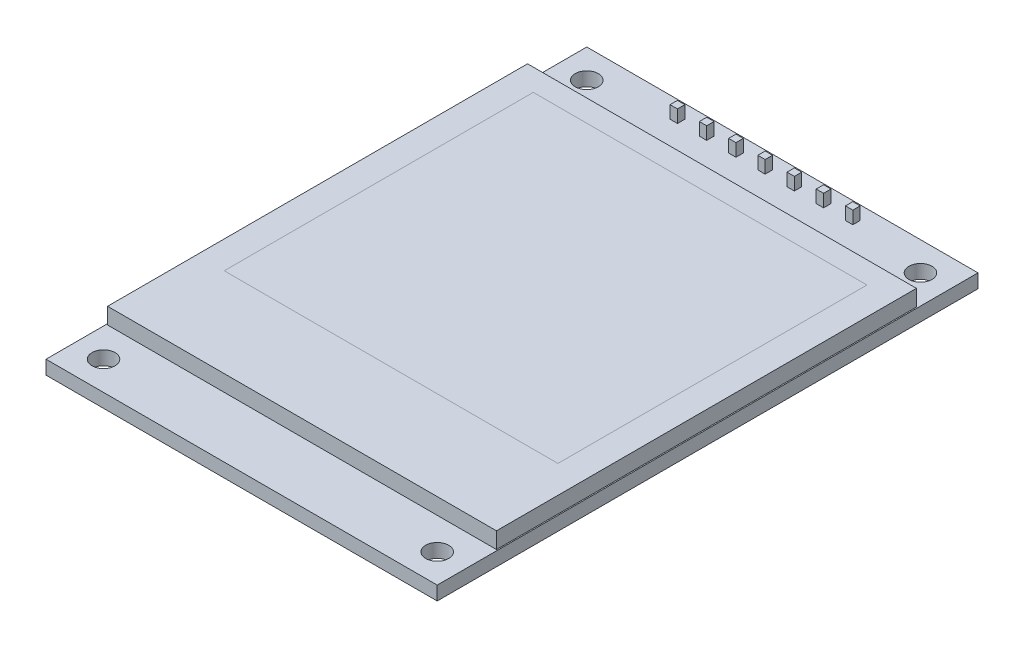
from build123d import *

# Parameters (mm, degrees)
PCB_2_W                   = 34
PCB_2_H                   = 47
PCB_2_R                   = 1
PCB_DEPTH                 = 1.2
OLED_2_W                  = 29
OLED_2_H                  = 26.86
OLED_DEPTH                = 1.41
OLED_3_2_W                = 29
OLED_3_2_H                = 26.86
OLED_3_DEPTH              = 1.41
SKETCH_2_54_W             = 17.78
SKETCH_2_54_H             = 2.54
SKETCH_2_54_W_2           = 0.64
SKETCH_2_54_H_2           = 0.64
EXTRUDE_2_54_0_DEPTH      = 2.5
EXTRUDE_2_54_1_DEPTH      = 9
EXTRUDE_2_54_1_DEPTH_BACK = 2.3
SKETCH_2_54_3_W           = 0.64
SKETCH_2_54_3_H           = 0.64


with BuildPart() as part:
    # PCB 2 → PCB (new body)
    with BuildSketch(Plane(origin=(0, 0, 0), x_dir=(1, 0, 0), z_dir=(0, 1, 0))):
        Rectangle(PCB_2_W, PCB_2_H)
        with Locations((-14.5, 21)):
            Circle(PCB_2_R, mode=Mode.SUBTRACT)
        with Locations((14.5, 21)):
            Circle(PCB_2_R, mode=Mode.SUBTRACT)
        with Locations((-14.5, -21)):
            Circle(PCB_2_R, mode=Mode.SUBTRACT)
        with Locations((14.5, -21)):
            Circle(PCB_2_R, mode=Mode.SUBTRACT)
    extrude(amount=PCB_DEPTH)

    # OLED 2 → OLED (add)
    with BuildSketch(Plane(origin=(0, 1.2, 0), x_dir=(1, 0, 0), z_dir=(0, 1, 0))):
        with Locations((0, 2.92)):
            Rectangle(OLED_2_W, OLED_2_H)
    extrude(amount=OLED_DEPTH)

    # 2.54针脚草图 → 2.54针脚0 (add)
    with BuildSketch(Plane.XZ):
        with Locations((0, -22)):
            Rectangle(SKETCH_2_54_W, SKETCH_2_54_H)
        with Locations((7.62, -22)):
            Rectangle(SKETCH_2_54_W_2, SKETCH_2_54_H_2, mode=Mode.SUBTRACT)
        with Locations((5.08, -22)):
            Rectangle(SKETCH_2_54_W_2, SKETCH_2_54_H_2, mode=Mode.SUBTRACT)
        with Locations((2.54, -22)):
            Rectangle(SKETCH_2_54_W_2, SKETCH_2_54_H_2, mode=Mode.SUBTRACT)
        with Locations((0, -22)):
            Rectangle(SKETCH_2_54_W_2, SKETCH_2_54_H_2, mode=Mode.SUBTRACT)
        with Locations((-2.54, -22)):
            Rectangle(SKETCH_2_54_W_2, SKETCH_2_54_H_2, mode=Mode.SUBTRACT)
        with Locations((-5.08, -22)):
            Rectangle(SKETCH_2_54_W_2, SKETCH_2_54_H_2, mode=Mode.SUBTRACT)
        with Locations((-7.62, -22)):
            Rectangle(SKETCH_2_54_W_2, SKETCH_2_54_H_2, mode=Mode.SUBTRACT)
    extrude(amount=EXTRUDE_2_54_0_DEPTH)

    # 2.54针脚草图<3> → 2.54针脚1 (add, two sides: drawn at the far end of the back side and taken through both)
    with BuildSketch(Plane.XZ.offset(-EXTRUDE_2_54_1_DEPTH_BACK)):
        with Locations((7.62, -22)):
            Rectangle(SKETCH_2_54_3_W, SKETCH_2_54_3_H)
        with Locations((5.08, -22)):
            Rectangle(SKETCH_2_54_3_W, SKETCH_2_54_3_H)
        with Locations((2.54, -22)):
            Rectangle(SKETCH_2_54_3_W, SKETCH_2_54_3_H)
        with Locations((0, -22)):
            Rectangle(SKETCH_2_54_3_W, SKETCH_2_54_3_H)
        with Locations((-2.54, -22)):
            Rectangle(SKETCH_2_54_3_W, SKETCH_2_54_3_H)
        with Locations((-5.08, -22)):
            Rectangle(SKETCH_2_54_3_W, SKETCH_2_54_3_H)
        with Locations((-7.62, -22)):
            Rectangle(SKETCH_2_54_3_W, SKETCH_2_54_3_H)
    extrude(amount=EXTRUDE_2_54_1_DEPTH + EXTRUDE_2_54_1_DEPTH_BACK)


with BuildPart() as body_2:
    # OLED_3 2 → OLED 3 (new body)
    with BuildSketch(Plane(origin=(0, 1.2, 0), x_dir=(1, 0, 0), z_dir=(0, 1, 0))):
        Polygon((16.9, 18.25), (-16.9, 18.25), (-16.9, 0), (-16.9, -18.25), (16.9, -18.25), align=None)
        with Locations((0, 2.92)):
            Rectangle(OLED_3_2_W, OLED_3_2_H, mode=Mode.SUBTRACT)
    extrude(amount=OLED_3_DEPTH)


solid = Compound([part.part, body_2.part])
